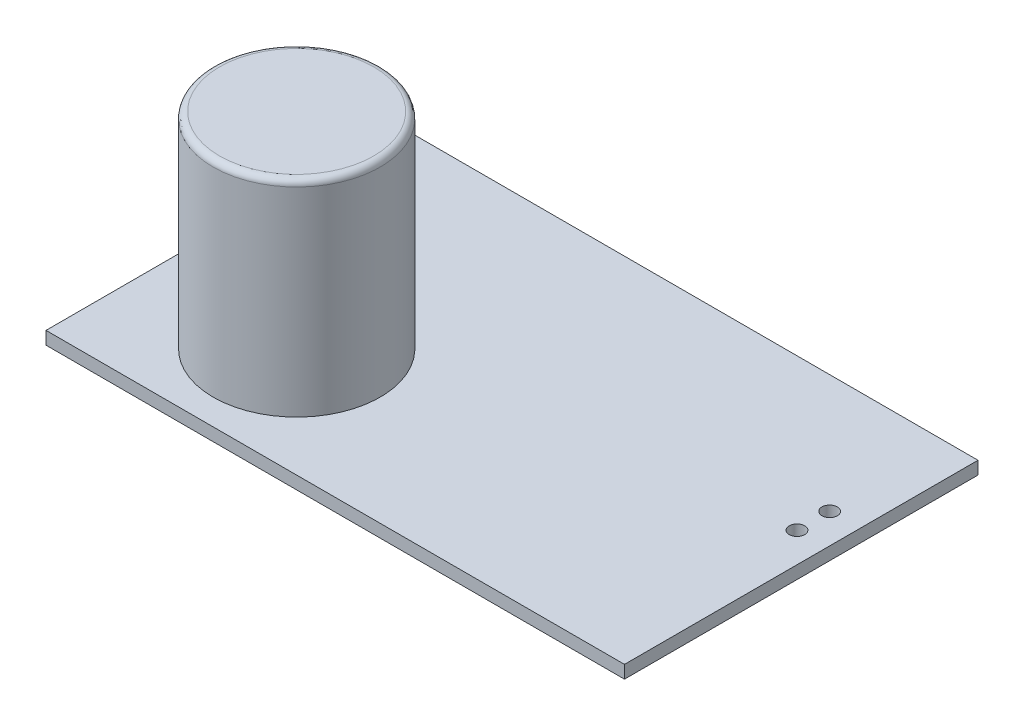
from build123d import *

# Parameters (mm, degrees)
SKETCH_1_W          = 45
SKETCH_1_H          = 27.5
EXTRUDE_1_DEPTH     = 1
SKETCH_2_R          = 6.5
EXTRUDE_2_DEPTH     = 16
FILLET_1_R          = 0.5
SKETCH_5_R          = 0.6
CUT_EXTRUDE_1_DEPTH = 56.11125112


with BuildPart() as part:
    # Эскиз1 → Бобышка-Вытянуть1 (new body)
    with BuildSketch(Plane(origin=(0, 0, 0), x_dir=(1, 0, 0), z_dir=(0, 1, 0))):
        with Locations((22.5, 13.75)):
            Rectangle(SKETCH_1_W, SKETCH_1_H)
    extrude(amount=EXTRUDE_1_DEPTH)

    # Эскиз5 → Вырез-Вытянуть1 (cut, through all)
    with BuildSketch(Plane(origin=(0, 1, 0), x_dir=(1, 0, 0), z_dir=(0, 1, 0))):
        with Locations(Location((2.032, 14.224, 0), (0, 0, 270))):
            Circle(SKETCH_5_R)
        with Locations(Location((2.032, 11.684, 0), (0, 0, 270))):
            Circle(SKETCH_5_R)
        with Locations(Location((42.672, 18.288, 0), (0, 0, 270))):
            Circle(SKETCH_5_R)
        with Locations(Location((42.672, 15.748, 0), (0, 0, 270))):
            Circle(SKETCH_5_R)
    extrude(amount=-CUT_EXTRUDE_1_DEPTH, mode=Mode.SUBTRACT)


with BuildPart() as body_2:
    # Эскиз2 → Бобышка-Вытянуть2 (new body)
    with BuildSketch(Plane(origin=(0, 1, 0), x_dir=(1, 0, 0), z_dir=(0, 1, 0))):
        with Locations(Location((11, 8.5, 0), (0, 0, 270))):
            Circle(SKETCH_2_R)
    extrude(amount=EXTRUDE_2_DEPTH)

    # Скругление1
    fillet_1_edges = [body_2.edges().sort_by_distance(p)[0] for p in [
        (11, 17, -15),
    ]]
    fillet(fillet_1_edges, radius=FILLET_1_R)


solid = Compound([part.part, body_2.part])
